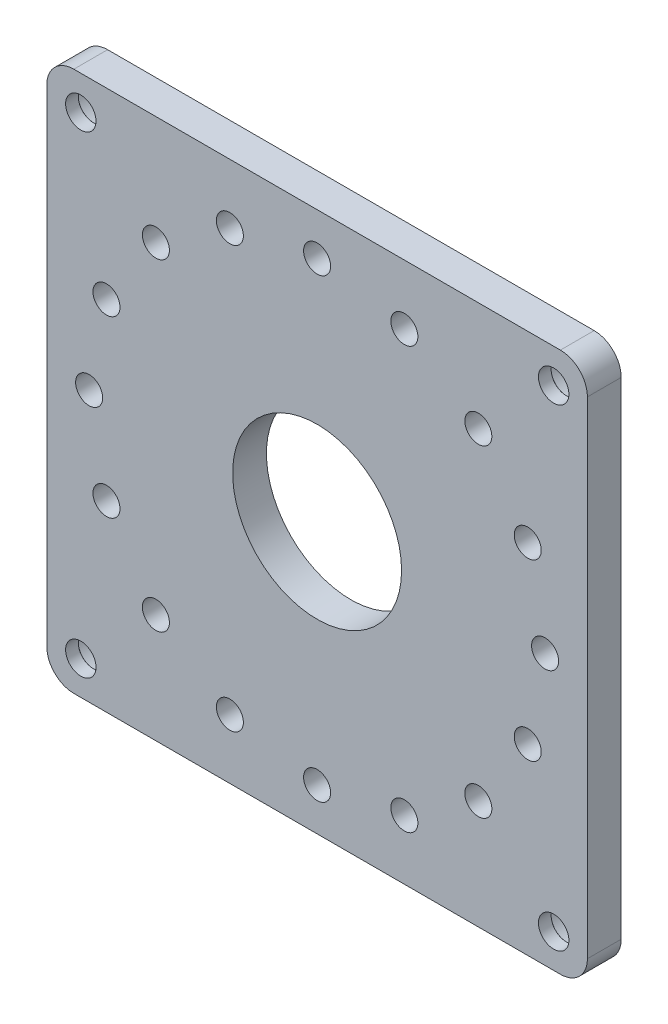
from build123d import *

# Parameters (mm, degrees)
ESQUISSE1_R                                = 12.5
ESQUISSE1_R_2                              = 2
BOSS_EXTRU_1_DEPTH                         = 5
D_GAGEMENT_M41_D                           = 4.5
CHAMBRAGE_POUR_VIS_T_TE_RONDE_BOMB_2_COUNT = 2
CHAMBRAGE_POUR_VIS_T_TE_RONDE_BOMB_2_PITCH = 69.975976343
CHAMBRAGE_POUR_VIS_T_TE_RONDE_BOMB_3_COUNT = 2
CHAMBRAGE_POUR_VIS_T_TE_RONDE_BOMB_3_PITCH = 98.968247754
CHAMBRAGE_POUR_VIS_T_TE_RONDE_BOMB_4_COUNT = 2
CHAMBRAGE_POUR_VIS_T_TE_RONDE_BOMB_4_PITCH = 69.986261497


with BuildPart() as part:
    # Esquisse1 → Boss.-Extru.1 (new body)
    with BuildSketch(Plane.XY):
        with BuildLine():
            Line((-36, -40), (36, -40))
            ThreePointArc((36, -40), (38.828427125, -38.828427125), (40, -36))
            Line((40, -36), (40, 36))
            ThreePointArc((40, 36), (38.828427125, 38.828427125), (36, 40))
            Line((36, 40), (-36, 40))
            ThreePointArc((-36, 40), (-38.828427125, 38.828427125), (-40, 36))
            Line((-40, 36), (-40, -36))
            ThreePointArc((-40, -36), (-38.828427125, -38.828427125), (-36, -40))
        make_face()
        Circle(ESQUISSE1_R, mode=Mode.SUBTRACT)
        with Locations((0, 33.738776676)):
            Circle(ESQUISSE1_R_2, mode=Mode.SUBTRACT)
        with Locations((12.911270862, 31.170565223)):
            Circle(ESQUISSE1_R_2, mode=Mode.SUBTRACT)
        with Locations((23.856917777, 23.856917777)):
            Circle(ESQUISSE1_R_2, mode=Mode.SUBTRACT)
        with Locations((31.170565223, 12.911270862)):
            Circle(ESQUISSE1_R_2, mode=Mode.SUBTRACT)
        with Locations((33.738776676, 0)):
            Circle(ESQUISSE1_R_2, mode=Mode.SUBTRACT)
        with Locations((31.170565223, -12.911270862)):
            Circle(ESQUISSE1_R_2, mode=Mode.SUBTRACT)
        with Locations((23.856917777, -23.856917777)):
            Circle(ESQUISSE1_R_2, mode=Mode.SUBTRACT)
        with Locations((12.911270862, -31.170565223)):
            Circle(ESQUISSE1_R_2, mode=Mode.SUBTRACT)
        with Locations((0, -33.738776676)):
            Circle(ESQUISSE1_R_2, mode=Mode.SUBTRACT)
        with Locations((-12.911270862, -31.170565223)):
            Circle(ESQUISSE1_R_2, mode=Mode.SUBTRACT)
        with Locations((-23.856917777, -23.856917777)):
            Circle(ESQUISSE1_R_2, mode=Mode.SUBTRACT)
        with Locations((-31.170565223, -12.911270862)):
            Circle(ESQUISSE1_R_2, mode=Mode.SUBTRACT)
        with Locations((-33.738776676, 0)):
            Circle(ESQUISSE1_R_2, mode=Mode.SUBTRACT)
        with Locations((-31.170565223, 12.911270862)):
            Circle(ESQUISSE1_R_2, mode=Mode.SUBTRACT)
        with Locations((-23.856917777, 23.856917777)):
            Circle(ESQUISSE1_R_2, mode=Mode.SUBTRACT)
        with Locations((-12.911270862, 31.170565223)):
            Circle(ESQUISSE1_R_2, mode=Mode.SUBTRACT)
    extrude(amount=BOSS_EXTRU_1_DEPTH)

    # Dégagement M41 (through all)
    with Locations(Plane.XY.offset(5)):
        with Locations((-34.968353645, 34.962380164), (-34.968353645, -35.023881333), (35.007622699, -35.023881333), (35.007622699, 34.962380164)):
            Hole(D_GAGEMENT_M41_D / 2)

    # Esquisse10 → Chambrage pour vis à tête ronde bombée M41 (revolve, cut)
    with BuildSketch(Plane(origin=(35.007622699, 34.962380164, 0), x_dir=(0, 1, 0), z_dir=(1, 0, 0))):
        Polygon((0, 0), (0, 5), (2.25, 5), (2.25, 3.125), (2.275, 3.1), (4.5, 3.1), (4.5, 0), align=None)
    chambrage_pour_vis_t_te_ronde_bomb_e_m = revolve(axis=Axis((35.007622699, 34.962380164, -6.35), (0, 0, 1)), mode=Mode.SUBTRACT)

    # Chambrage pour vis _ t_te ronde bomb 2: Chambrage pour vis à tête ronde bombée M41 ×2
    with Locations(*[(-i * CHAMBRAGE_POUR_VIS_T_TE_RONDE_BOMB_2_PITCH, 0, 0) for i in range(1, CHAMBRAGE_POUR_VIS_T_TE_RONDE_BOMB_2_COUNT)]):
        add(chambrage_pour_vis_t_te_ronde_bomb_e_m, mode=Mode.SUBTRACT)

    # Chambrage pour vis _ t_te ronde bomb 3: Chambrage pour vis à tête ronde bombée M41 ×2
    with Locations(*[Vector(-0.7070548173920428, -0.7071587411626226, 0) * (i * CHAMBRAGE_POUR_VIS_T_TE_RONDE_BOMB_3_PITCH) for i in range(1, CHAMBRAGE_POUR_VIS_T_TE_RONDE_BOMB_3_COUNT)]):
        add(chambrage_pour_vis_t_te_ronde_bomb_e_m, mode=Mode.SUBTRACT)

    # Chambrage pour vis _ t_te ronde bomb 4: Chambrage pour vis à tête ronde bombée M41 ×2
    with Locations(*[(0, -i * CHAMBRAGE_POUR_VIS_T_TE_RONDE_BOMB_4_PITCH, 0) for i in range(1, CHAMBRAGE_POUR_VIS_T_TE_RONDE_BOMB_4_COUNT)]):
        add(chambrage_pour_vis_t_te_ronde_bomb_e_m, mode=Mode.SUBTRACT)


solid = part.part
